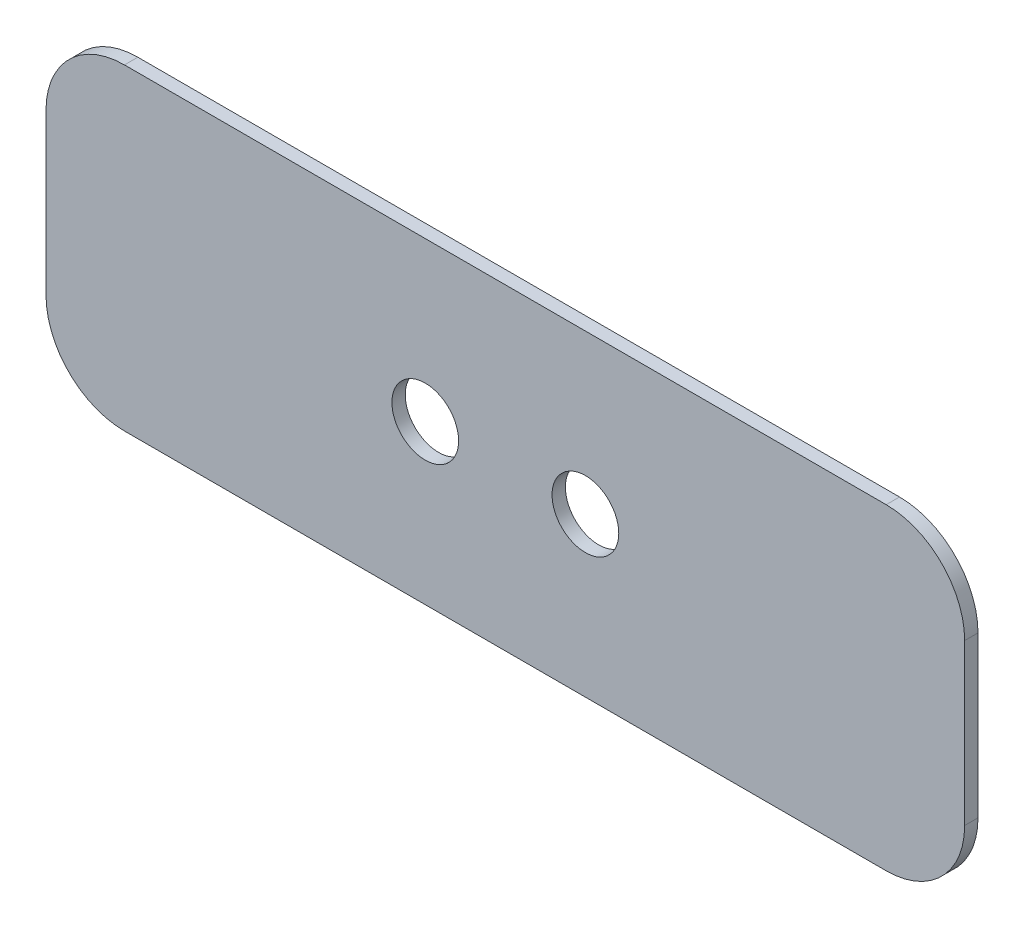
from build123d import *

# Parameters (mm, degrees)
BOSS_EXTRUDE1_DEPTH = 6.35
CUT_EXTRUDE1_REACH  = 310.984
SKETCH3_R           = 15.875


with BuildPart() as part:
    # Sketch2 → Boss-Extrude1 (new body)
    with BuildSketch(Plane.XY):
        with BuildLine():
            Line((218.563766336, -180.975), (218.563766336, -104.775))
            ThreePointArc((218.563766336, -104.775), (207.627719332, -78.373047004), (181.225766336, -67.437))
            Line((181.225766336, -67.437), (-181.225766336, -67.437))
            ThreePointArc((-181.225766336, -67.437), (-207.627719332, -78.373047004), (-218.563766336, -104.775))
            Line((-218.563766336, -104.775), (-218.563766336, -180.975))
            ThreePointArc((-218.563766336, -180.975), (-207.627719332, -207.376952996), (-181.225766336, -218.313))
            Line((-181.225766336, -218.313), (181.225766336, -218.313))
            ThreePointArc((181.225766336, -218.313), (207.627719332, -207.376952996), (218.563766336, -180.975))
        make_face()
    extrude(amount=BOSS_EXTRUDE1_DEPTH)

    # Sketch3 → Cut-Extrude1 (cut, up to next)
    with BuildSketch(Plane.XY.offset(6.35), mode=Mode.PRIVATE) as cut_extrude1_sk1:
        with Locations((-38.1, -142.875)):
            Circle(SKETCH3_R)
    cut_extrude1_tool1 = extrude(cut_extrude1_sk1.sketch, amount=-CUT_EXTRUDE1_REACH, mode=Mode.PRIVATE) & part.part
    # Sketch3 → Cut-Extrude1 (cut, up to next)
    with BuildSketch(Plane.XY.offset(6.35), mode=Mode.PRIVATE) as cut_extrude1_sk2:
        with Locations((38.1, -142.875)):
            Circle(SKETCH3_R)
    cut_extrude1_tool2 = extrude(cut_extrude1_sk2.sketch, amount=-CUT_EXTRUDE1_REACH, mode=Mode.PRIVATE) & part.part
    add(cut_extrude1_tool1.solids().sort_by_distance((-38.1, -142.875, 6.35))[0], mode=Mode.SUBTRACT)
    add(cut_extrude1_tool2.solids().sort_by_distance((38.1, -142.875, 6.35))[0], mode=Mode.SUBTRACT)


solid = part.part
